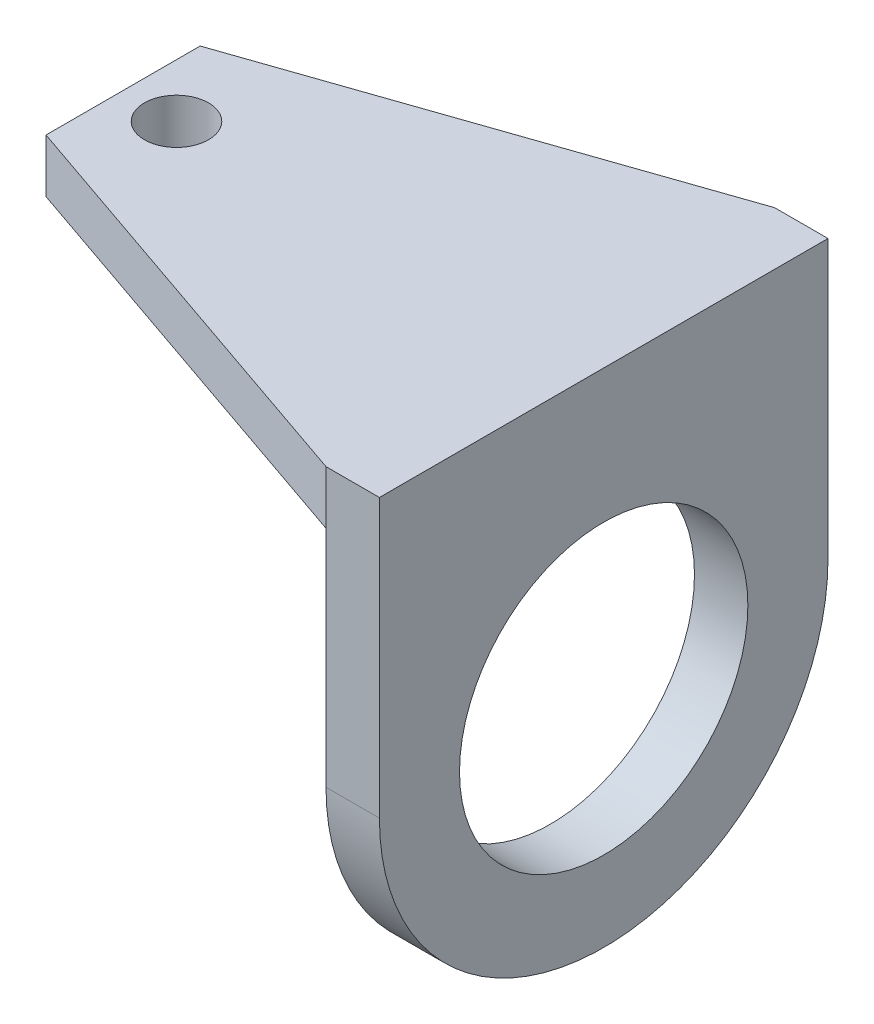
from build123d import *

# Parameters (mm, degrees)
SKETCH1_R                = 21
SKETCH1_R_2              = 13.5
BOSS_EXTRUDE1_DEPTH      = 5
BOSS_EXTRUDE2_REACH      = 49.223
BOSS_EXTRUDE2_END_RADIUS = 21
SKETCH2_W                = 5
SKETCH2_H                = 42
SKETCH2_3_W              = 45
SKETCH2_3_H              = 42
SKETCH2_3_R              = 3
BOSS_EXTRUDE3_DEPTH      = 5
CUT_EXTRUDE4_DEPTH       = 62.684682053


with BuildPart() as part:
    # Sketch1 → Boss-Extrude1 (new body)
    with BuildSketch(Plane(origin=(0, 0, 0), x_dir=(0, 0, -1), z_dir=(1, 0, 0))):
        Circle(SKETCH1_R)
        Circle(SKETCH1_R_2, mode=Mode.SUBTRACT)
    extrude(amount=BOSS_EXTRUDE1_DEPTH)

    # Boss-Extrude2: up to this cylinder (the profile starts outside it)
    boss_extrude2_end = Plane(origin=(2.5, 0, 0), z_dir=(-1, 0, 0)) * Cylinder(BOSS_EXTRUDE2_END_RADIUS, 141.446, mode=Mode.PRIVATE)
    # Sketch2 → Boss-Extrude2 (add, up to the surface)
    with BuildSketch(Plane(origin=(0, 21, 0), x_dir=(1, 0, 0), z_dir=(0, 1, 0)), mode=Mode.PRIVATE) as boss_extrude2_sk1:
        with Locations((2.5, 0)):
            Rectangle(SKETCH2_W, SKETCH2_H)
    boss_extrude2_tool1 = extrude(boss_extrude2_sk1.sketch, amount=-BOSS_EXTRUDE2_REACH, mode=Mode.PRIVATE) - boss_extrude2_end
    add(boss_extrude2_tool1.solids().sort_by_distance((2.5, 21, 0))[0])
    add(boss_extrude2_tool1.solids().sort_by_distance((2.5, 21, 0))[1])

    # Sketch2<3> → Boss-Extrude3 (add)
    with BuildSketch(Plane(origin=(0, 21, 0), x_dir=(1, 0, 0), z_dir=(0, 1, 0))):
        with Locations((-17.5, 0)):
            Rectangle(SKETCH2_3_W, SKETCH2_3_H)
        with Locations((-35, 0)):
            Circle(SKETCH2_3_R, mode=Mode.SUBTRACT)
    extrude(amount=BOSS_EXTRUDE3_DEPTH)

    # Sketch3 → Cut-Extrude4 (cut, through all)
    with BuildSketch(Plane.XZ.offset(-21)):
        Polygon((-40, -7.216009452), (-40, -28.471778575), (0, -28.471778575), (0, -21), align=None)
        Polygon((-40, 27.25128432), (-40, 7.216009452), (0, 21), (0, 27.25128432), align=None)
    extrude(amount=-CUT_EXTRUDE4_DEPTH, mode=Mode.SUBTRACT)


solid = part.part
